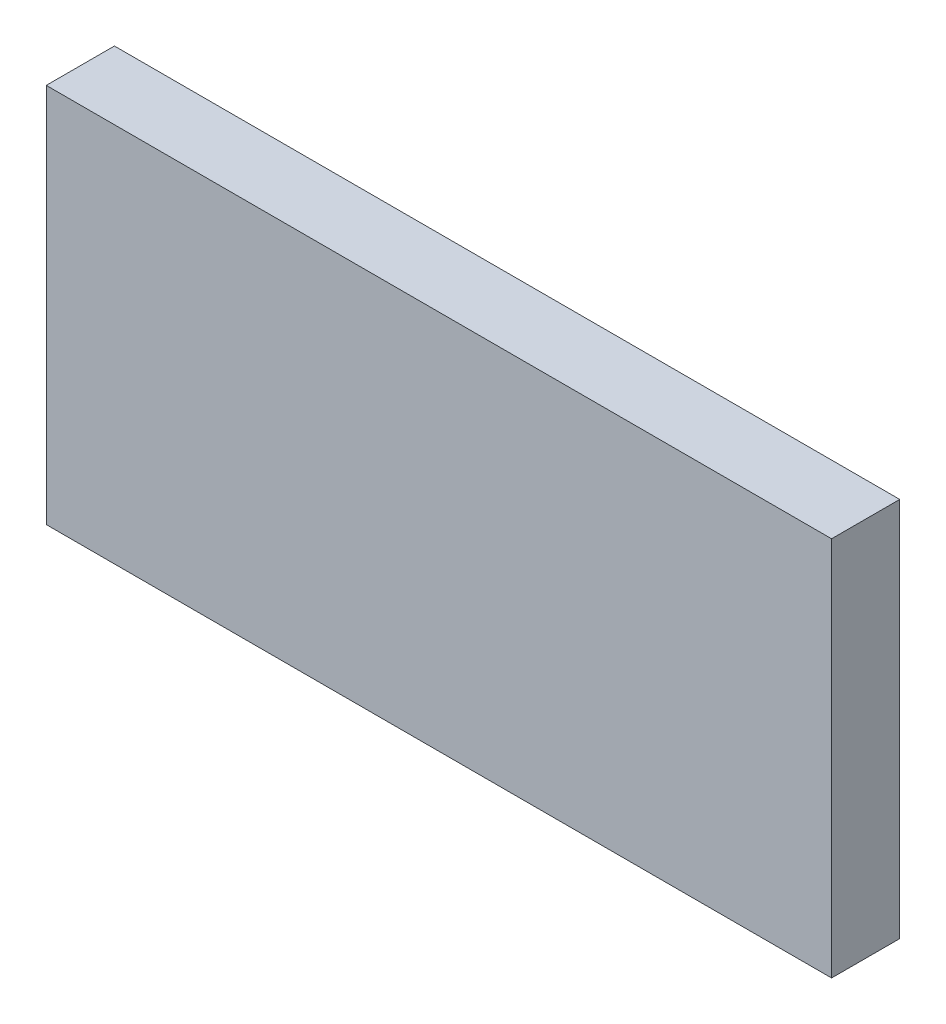
from build123d import *

# Parameters (mm, degrees)
SKETCH1_W           = 48.768
SKETCH1_H           = 23.622
BOSS_EXTRUDE1_DEPTH = 4.233333333


with BuildPart() as part:
    # Sketch1 → Boss-Extrude1 (new body)
    with BuildSketch(Plane.XY):
        with Locations((-3.790789916, 7.86012605)):
            Rectangle(SKETCH1_W, SKETCH1_H)
    extrude(amount=BOSS_EXTRUDE1_DEPTH)


solid = part.part
